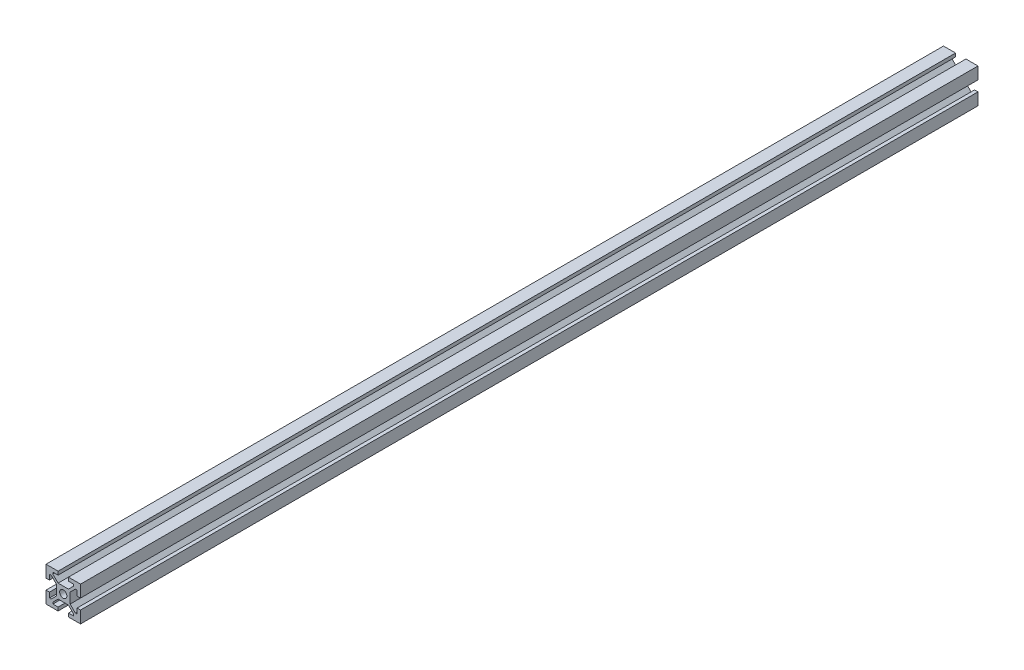
from build123d import *

# Parameters (mm, degrees)
SKETCH_2_R      = 2.1
EXTRUDE_1_DEPTH = 520


with BuildPart() as part:
    # ｽｹｯﾁ2 → ﾎﾞｽ - 押し出し1 (new body)
    with BuildSketch(Plane.XY):
        Polygon((3, 4), (-3, 4), (-6, 7), (-6, 8), (-3, 8), (-3, 10), (-10, 10), (-10, 3), (-8, 3), (-8, 6), (-7, 6), (-4, 3), (-4, -3), (-7, -6), (-8, -6), (-8, -3), (-10, -3), (-10, -10), (-3, -10), (-3, -8), (-6, -8), (-6, -7), (-3, -4), (3, -4), (6, -7), (6, -8), (3, -8), (3, -10), (10, -10), (10, -3), (8, -3), (8, -6), (7, -6), (4, -3), (4, 3), (7, 6), (8, 6), (8, 3), (10, 3), (10, 10), (3, 10), (3, 8), (6, 8), (6, 7), align=None)
        Circle(SKETCH_2_R, mode=Mode.SUBTRACT)
    extrude(amount=EXTRUDE_1_DEPTH)


solid = part.part
